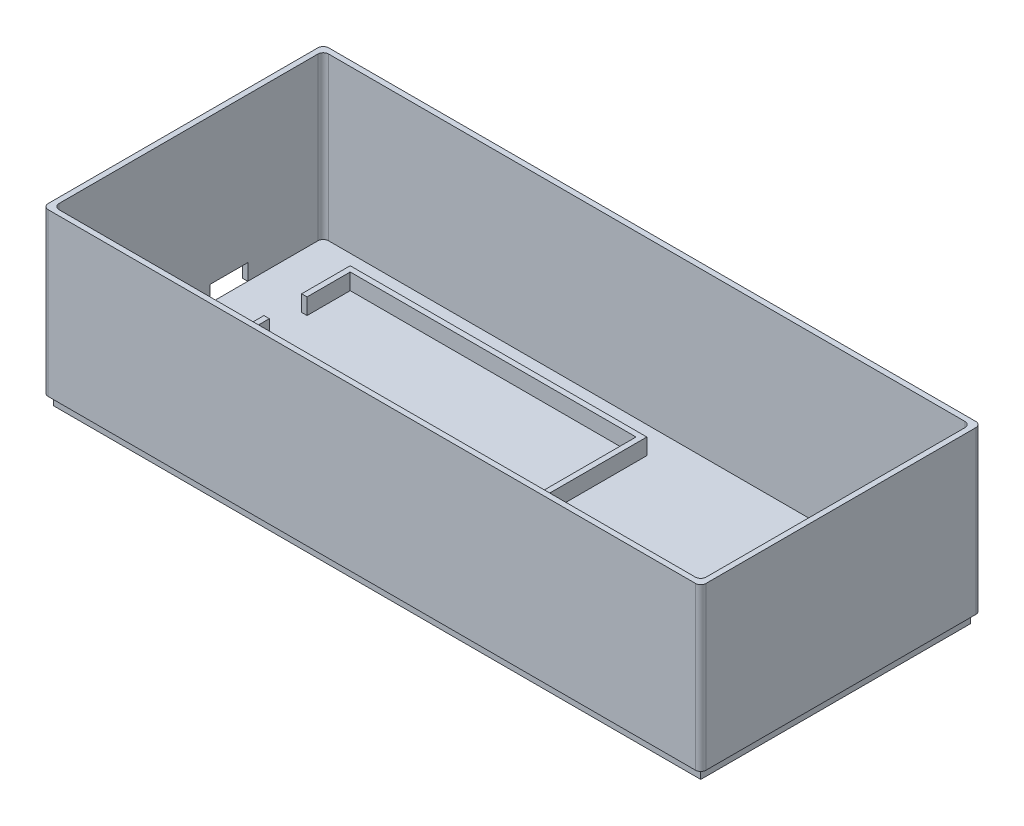
from build123d import *

# Parameters (mm, degrees)
SKETCH_1_W          = 120
SKETCH_1_H          = 50
EXTRUDE_1_DEPTH     = 2
SKETCH_2_W          = 55
SKETCH_2_H          = 25
SKETCH_2_W_2        = 53
SKETCH_2_H_2        = 23
EXTRUDE_1_2_DEPTH   = 3
EXTRUDE_2_DEPTH     = 3
CUT_EXTRUDE_1_REACH = 122.934
SKETCH_4_W          = 7
SKETCH_4_H          = 3
SKETCH_5_W          = 122
SKETCH_5_H          = 52
SKETCH_5_W_2        = 120
SKETCH_5_H_2        = 50
EXTRUDE_3_DEPTH     = 30
FILLET_1_R          = 1
SKETCH_6_W          = 7
SKETCH_6_H          = 3
CUT_EXTRUDE_2_DEPTH = 1


with BuildPart() as part:
    # 草图1 → Extrude 1 (new body)
    with BuildSketch(Plane(origin=(0, 0, 0), x_dir=(1, 0, 0), z_dir=(0, 1, 0))):
        with Locations((60, -25)):
            Rectangle(SKETCH_1_W, SKETCH_1_H)
    extrude(amount=EXTRUDE_1_DEPTH)

    # 草图2 → Extrude 1 2 (add)
    with BuildSketch(Plane(origin=(0, 2, 0), x_dir=(1, 0, 0), z_dir=(0, 1, 0))):
        with Locations((37.5, -17.5)):
            Rectangle(SKETCH_2_W, SKETCH_2_H)
        with Locations((37.5, -17.5)):
            Rectangle(SKETCH_2_W_2, SKETCH_2_H_2, mode=Mode.SUBTRACT)
    extrude(amount=EXTRUDE_1_2_DEPTH)

    # 草图3 → 拉伸-薄壁2 (add)
    with BuildSketch(Plane(origin=(0, 2, 0), x_dir=(1, 0, 0), z_dir=(0, 1, 0))):
        Polygon((10, -34), (33, -34), (33, -46), (10, -46), (10, -47), (34, -47), (34, -33), (10, -33), align=None)
    extrude(amount=EXTRUDE_2_DEPTH)

    # 草图4 → 切除-拉伸1 (cut, up to next)
    with BuildSketch(Plane.ZY.offset(-10), mode=Mode.PRIVATE) as cut_extrude_1_sk1:
        with Locations((17.5, 3.5)):
            Rectangle(SKETCH_4_W, SKETCH_4_H)
    cut_extrude_1_tool1 = extrude(cut_extrude_1_sk1.sketch, amount=-CUT_EXTRUDE_1_REACH, mode=Mode.PRIVATE) & part.part
    add(cut_extrude_1_tool1.solids().sort_by_distance((10, 3.5, 17.5))[0], mode=Mode.SUBTRACT)


with BuildPart() as body_2:
    # 草图5 → 拉伸-薄壁3 (new body)
    with BuildSketch(Plane(origin=(0, 2, 0), x_dir=(1, 0, 0), z_dir=(0, 1, 0))):
        with Locations((60, -25)):
            Rectangle(SKETCH_5_W, SKETCH_5_H)
        with Locations((60, -25)):
            Rectangle(SKETCH_5_W_2, SKETCH_5_H_2, mode=Mode.SUBTRACT)
    extrude(amount=EXTRUDE_3_DEPTH)

    # 圆角1
    fillet_1_edges = [body_2.edges().sort_by_distance(p)[0] for p in [
        (120, 17, 50),
        (120, 17, 0),
        (0, 17, 0),
        (0, 17, 50),
        (121, 17, 51),
        (-1, 17, 51),
        (-1, 17, -1),
        (121, 17, -1),
    ]]
    fillet(fillet_1_edges, radius=FILLET_1_R)

    # 草图6 → 切除-拉伸2 (cut)
    with BuildSketch(Plane.ZY.offset(1)):
        with Locations((17.5, 3.5)):
            Rectangle(SKETCH_6_W, SKETCH_6_H)
    extrude(amount=-CUT_EXTRUDE_2_DEPTH, mode=Mode.SUBTRACT)


solid = Compound([part.part, body_2.part])
